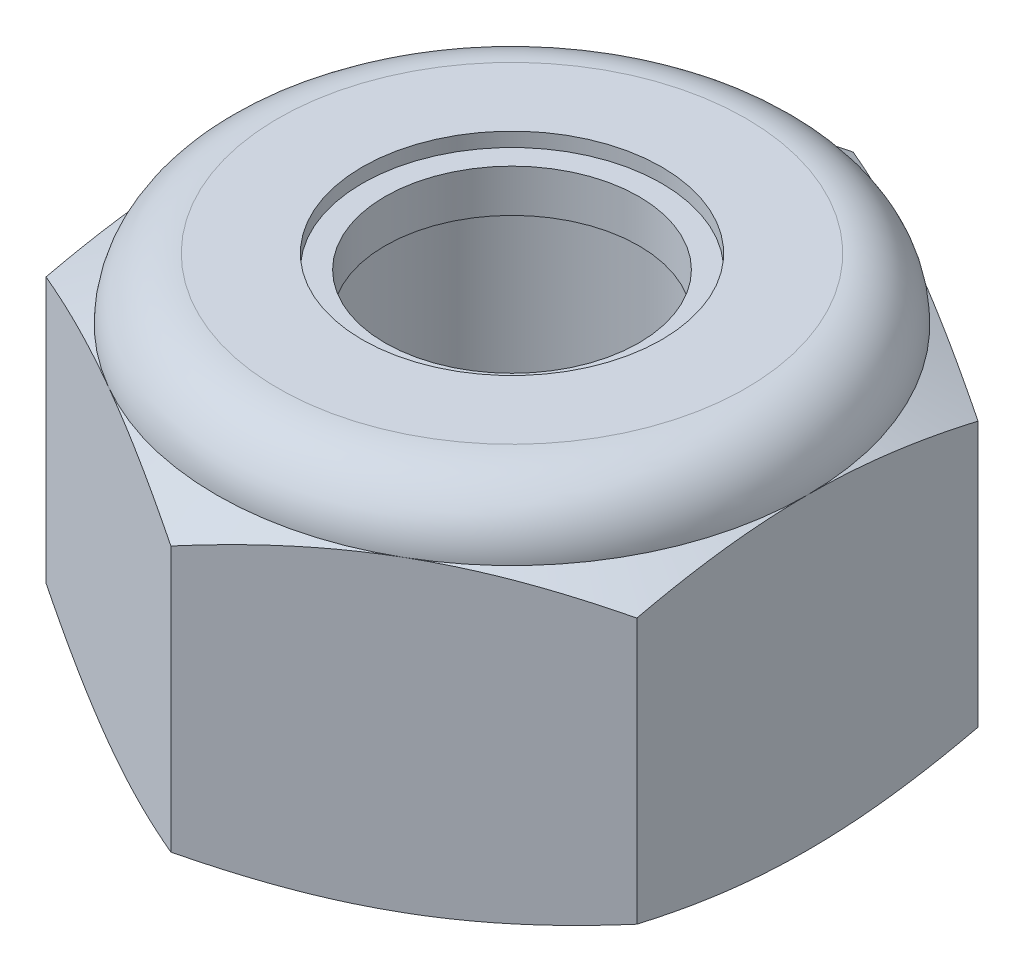
from build123d import *

# Parameters (mm, degrees)
EXTRUDE1_DEPTH = 5.953125
SKETCH2_W      = 2.413
SKETCH2_H      = 5.953125


with BuildPart() as part:
    # Sketch1 → Extrude1 (new body)
    with BuildSketch(Plane(origin=(0, 0, 0), x_dir=(1, 0, 0), z_dir=(0, 1, 0))):
        Polygon((0, 5.499261314), (-4.7625, 2.749630657), (-4.7625, -2.749630657), (0, -5.499261314), (4.7625, -2.749630657), (4.7625, 2.749630657), align=None)
    extrude(amount=EXTRUDE1_DEPTH)


with BuildPart() as body_2:
    # Sketch2 → Revolve1 (revolve)
    with BuildSketch(Plane(origin=(0, 0, 0), x_dir=(0, 0, -1), z_dir=(1, 0, 0))):
        with Locations((1.2065, 2.9765625)):
            Rectangle(SKETCH2_W, SKETCH2_H)
    revolve(axis=Axis((0, -2.413, 0), (0, 1, 0)))


with BuildPart() as part_1:
    add(part.part)

    # Combine1: cut body 2
    add(body_2.part, mode=Mode.SUBTRACT)

    # Sketch5 → Cut-Revolve3 (revolve, cut)
    with BuildSketch(Plane(origin=(0, 0, 0), x_dir=(0, 0, -1), z_dir=(1, 0, 0))):
        with BuildLine():
            Line((0, 0), (4.7625, 0))
            Line((4.7625, 0), (5.499261314, 0.343557443))
            Line((5.499261314, 0.343557443), (5.499261314, 4.617380057))
            Line((5.499261314, 4.617380057), (4.7625, 4.9609375))
            ThreePointArc((4.7625, 4.9609375), (4.471895009, 5.662520009), (3.7703125, 5.953125))
            Line((3.7703125, 5.953125), (3.7703125, 7.223125))
            Line((3.7703125, 7.223125), (6.769261314, 7.223125))
            Line((6.769261314, 7.223125), (6.769261314, -1.27))
            Line((6.769261314, -1.27), (0, -1.27))
            Line((0, -1.27), (0, 0))
        make_face()
    revolve(axis=Axis((0, 0, 0), (0, 1, 0)), mode=Mode.SUBTRACT)


with BuildPart() as body_2_2:
    # Sketch7 → Revolve2 (revolve)
    with BuildSketch(Plane(origin=(0, 0, 0), x_dir=(0, 0, -1), z_dir=(1, 0, 0))):
        with BuildLine():
            Line((2.045424837, 5.0371375), (4.530088408, 5.0371375))
            ThreePointArc((4.530088408, 5.0371375), (4.282601726, 5.527175629), (3.7703125, 5.724525))
            Line((3.7703125, 5.724525), (2.045424837, 5.724525))
            Line((2.045424837, 5.724525), (2.045424837, 5.0371375))
        make_face()
    revolve(axis=Axis((0, 5.0371375, 0), (0, 1, 0)))


solid = Compound([part_1.part, body_2_2.part])
